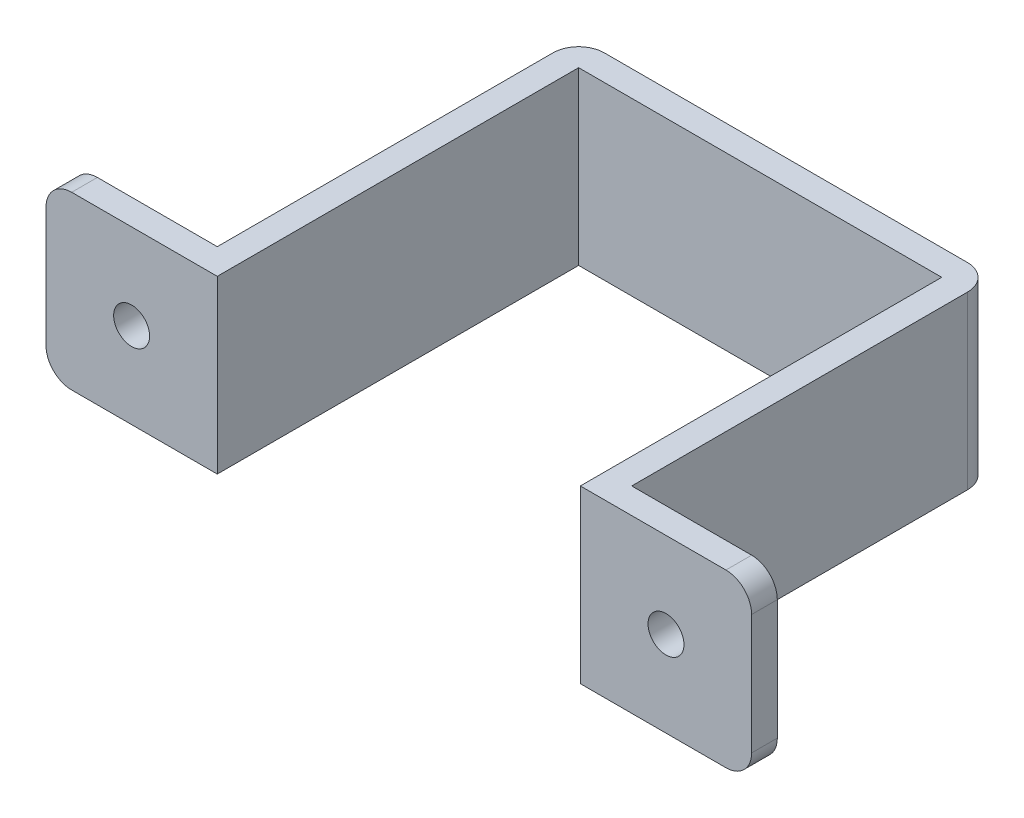
from build123d import *

# Parameters (mm, degrees)
EXTRUDE_1_DEPTH     = 20
FILLET_1_R          = 3
FILLET_2_R          = 3
SKETCH_3_R          = 2.1
CUT_EXTRUDE_1_DEPTH = 10


with BuildPart() as part:
    # 草图1 → 凸台-拉伸1 (new body)
    with BuildSketch(Plane(origin=(0, 0, 0), x_dir=(1, 0, 0), z_dir=(0, 1, 0))):
        Polygon((-21.2, 6.013269655), (-21.2, 0), (-41.2, 0), (-41.2, 3), (-24.2, 3), (-24.2, 45.2), (24.2, 45.2), (24.2, 3), (41.2, 3), (41.2, 0), (21.2, 0), (21.2, 6.013269655), (21.2, 42.2), (-21.2, 42.2), align=None)
    extrude(amount=EXTRUDE_1_DEPTH)

    # 圆角1
    fillet_1_edges = [part.edges().sort_by_distance(p)[0] for p in [
        (-24.2, 10, -45.2),
        (24.2, 10, -45.2),
    ]]
    fillet(fillet_1_edges, radius=FILLET_1_R)

    # 圆角2
    fillet_2_edges = [part.edges().sort_by_distance(p)[0] for p in [
        (-41.2, 20, -1.5),
        (41.2, 0, -1.5),
        (-41.2, 0, -1.5),
        (41.2, 20, -1.5),
    ]]
    fillet(fillet_2_edges, radius=FILLET_2_R)

    # 草图3 → 切除-拉伸1 (cut)
    with BuildSketch(Plane(origin=(0, 0, -3), x_dir=(-1, 0, 0), z_dir=(0, 0, -1))):
        with Locations((31.2, 10)):
            Circle(SKETCH_3_R)
        with Locations((-31.2, 10)):
            Circle(SKETCH_3_R)
    extrude(amount=-CUT_EXTRUDE_1_DEPTH, mode=Mode.SUBTRACT)


solid = part.part
